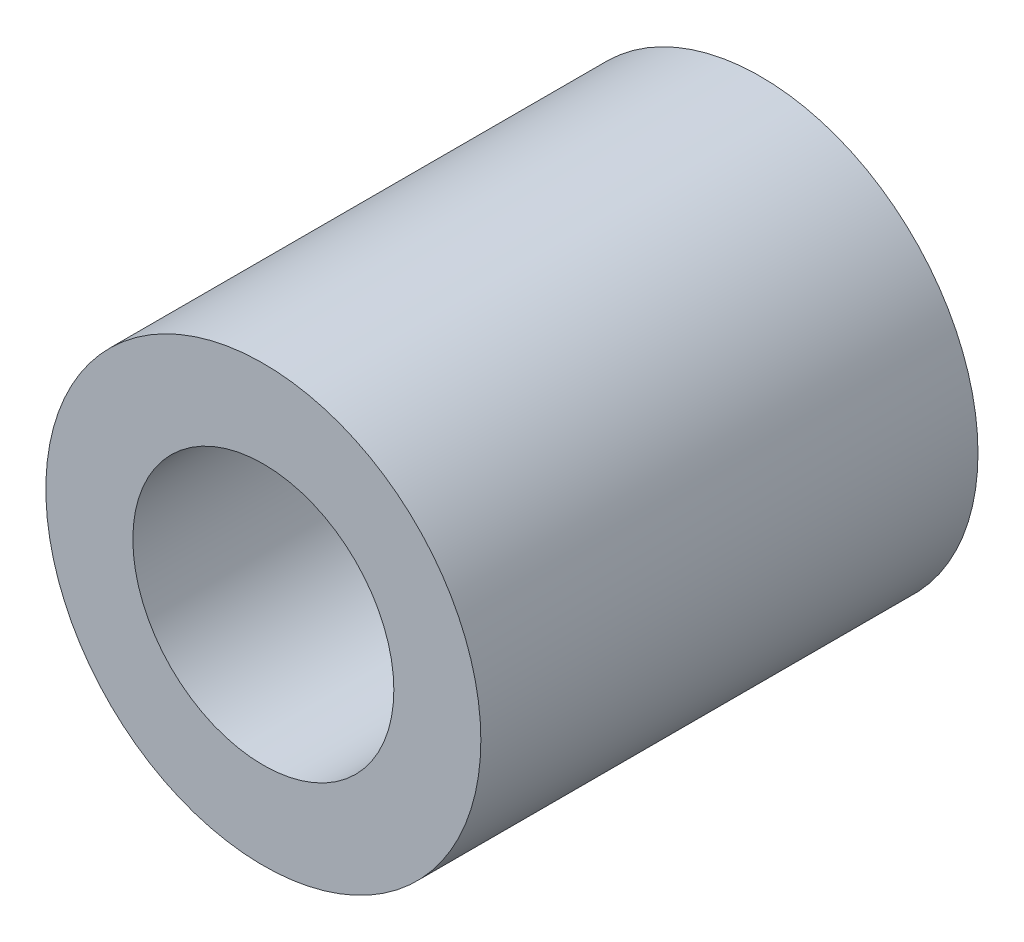
from build123d import *

# Parameters (mm, degrees)
SKETCH_1_R      = 3.5
SKETCH_1_R_2    = 2.1
EXTRUDE_1_DEPTH = 8


with BuildPart() as part:
    # 草图1 → 凸台-拉伸1 (new body)
    with BuildSketch(Plane.XY):
        Circle(SKETCH_1_R)
        Circle(SKETCH_1_R_2, mode=Mode.SUBTRACT)
    extrude(amount=EXTRUDE_1_DEPTH)


solid = part.part
